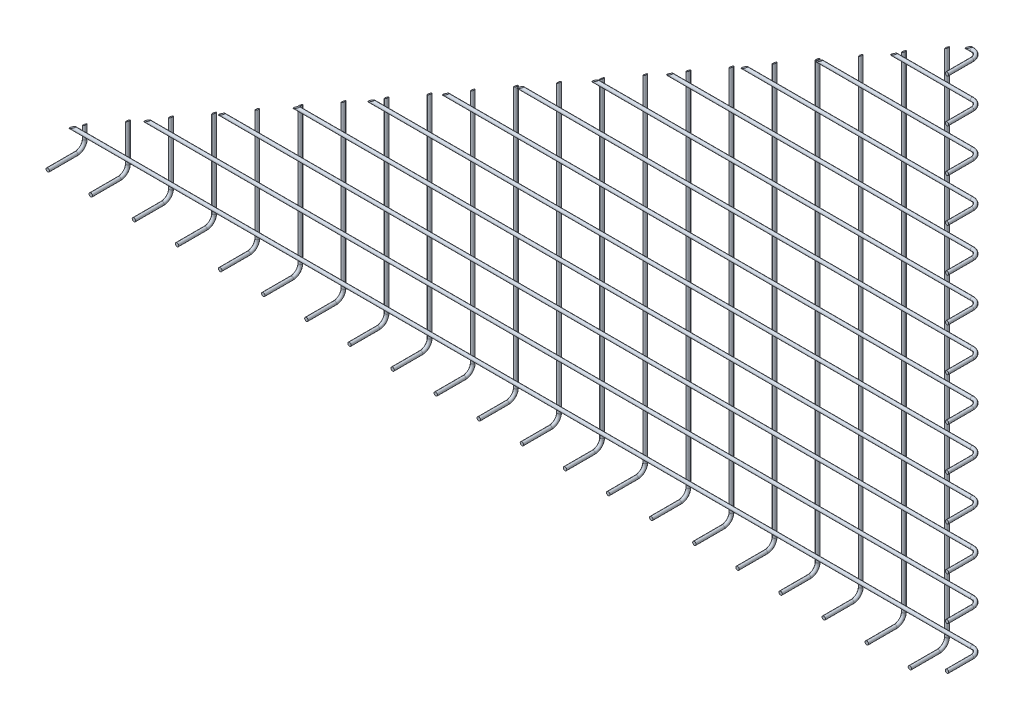
from build123d import *

# Parameters (mm, degrees)
SKETCH_1_R               = 2
PATTERN_LINEAR_1_COUNT   = 11
PATTERN_LINEAR_1_PITCH   = 50
SKETCH_4_R               = 2
PATTERN_LINEAR_2_COUNT   = 17
PATTERN_LINEAR_2_PITCH   = 50
CUT_EXTRUDE_1_DEPTH      = 1012.697275829
CUT_EXTRUDE_1_DEPTH_BACK = 1012.697275829
SKETCH_5_OUTSIDE_W       = 1368.726
SKETCH_5_OUTSIDE_H       = 1129.783


with BuildPart() as part:
    # По траектории1: sweep along a path in Эскиз2
    with BuildLine(Plane(origin=(0, 0, 0), x_dir=(0, 0, -1), z_dir=(1, 0, 0))) as sweep_1_path:
        Line((-47, 2), (-14, 2))
        ThreePointArc((-14, 2), (-6.928932188, 4.928932188), (-4, 12))
        Line((-4, 12), (-4, 851.056624327))
    # Эскиз1 → По траектории1 (sweep)
    with BuildSketch(Plane.XY.offset(47)):
        with Locations((0, 2)):
            Circle(SKETCH_1_R)
    sweep(path=sweep_1_path.line)


with BuildPart() as pattern_linear_1_1:
    # Линейный массив1: pattern copy
    add(part.part.moved(Location(Vector(1, 0, 0) * (1 * PATTERN_LINEAR_1_PITCH))))


with BuildPart() as pattern_linear_1_2:
    # Линейный массив1: pattern copy
    add(part.part.moved(Location(Vector(1, 0, 0) * (2 * PATTERN_LINEAR_1_PITCH))))


with BuildPart() as pattern_linear_1_3:
    # Линейный массив1: pattern copy
    add(part.part.moved(Location(Vector(1, 0, 0) * (3 * PATTERN_LINEAR_1_PITCH))))


with BuildPart() as pattern_linear_1_4:
    # Линейный массив1: pattern copy
    add(part.part.moved(Location(Vector(1, 0, 0) * (4 * PATTERN_LINEAR_1_PITCH))))


with BuildPart() as pattern_linear_1_5:
    # Линейный массив1: pattern copy
    add(part.part.moved(Location(Vector(1, 0, 0) * (5 * PATTERN_LINEAR_1_PITCH))))


with BuildPart() as pattern_linear_1_6:
    # Линейный массив1: pattern copy
    add(part.part.moved(Location(Vector(1, 0, 0) * (6 * PATTERN_LINEAR_1_PITCH))))


with BuildPart() as pattern_linear_1_7:
    # Линейный массив1: pattern copy
    add(part.part.moved(Location(Vector(1, 0, 0) * (7 * PATTERN_LINEAR_1_PITCH))))


with BuildPart() as pattern_linear_1_8:
    # Линейный массив1: pattern copy
    add(part.part.moved(Location(Vector(1, 0, 0) * (8 * PATTERN_LINEAR_1_PITCH))))


with BuildPart() as pattern_linear_1_9:
    # Линейный массив1: pattern copy
    add(part.part.moved(Location(Vector(1, 0, 0) * (9 * PATTERN_LINEAR_1_PITCH))))


with BuildPart() as pattern_linear_1_10:
    # Линейный массив1: pattern copy
    add(part.part.moved(Location(Vector(1, 0, 0) * (10 * PATTERN_LINEAR_1_PITCH))))


with BuildPart() as body_12:
    # Зеркальное отражение1: mirrored copy
    add(pattern_linear_1_10.part.mirror(Plane(origin=(0, 0, 0), x_dir=(0, 0, 1), z_dir=(1, 0, 0))))


with BuildPart() as body_13:
    # Mirror 1 2: mirrored copy
    add(pattern_linear_1_9.part.mirror(Plane(origin=(0, 0, 0), x_dir=(0, 0, 1), z_dir=(1, 0, 0))))


with BuildPart() as body_14:
    # Mirror 1 3: mirrored copy
    add(pattern_linear_1_8.part.mirror(Plane(origin=(0, 0, 0), x_dir=(0, 0, 1), z_dir=(1, 0, 0))))


with BuildPart() as body_15:
    # Mirror 1 4: mirrored copy
    add(pattern_linear_1_7.part.mirror(Plane(origin=(0, 0, 0), x_dir=(0, 0, 1), z_dir=(1, 0, 0))))


with BuildPart() as body_16:
    # Mirror 1 5: mirrored copy
    add(pattern_linear_1_6.part.mirror(Plane(origin=(0, 0, 0), x_dir=(0, 0, 1), z_dir=(1, 0, 0))))


with BuildPart() as body_17:
    # Mirror 1 6: mirrored copy
    add(pattern_linear_1_5.part.mirror(Plane(origin=(0, 0, 0), x_dir=(0, 0, 1), z_dir=(1, 0, 0))))


with BuildPart() as body_18:
    # Mirror 1 7: mirrored copy
    add(pattern_linear_1_4.part.mirror(Plane(origin=(0, 0, 0), x_dir=(0, 0, 1), z_dir=(1, 0, 0))))


with BuildPart() as body_19:
    # Mirror 1 8: mirrored copy
    add(pattern_linear_1_3.part.mirror(Plane(origin=(0, 0, 0), x_dir=(0, 0, 1), z_dir=(1, 0, 0))))


with BuildPart() as body_20:
    # Mirror 1 9: mirrored copy
    add(pattern_linear_1_2.part.mirror(Plane(origin=(0, 0, 0), x_dir=(0, 0, 1), z_dir=(1, 0, 0))))


with BuildPart() as body_21:
    # Mirror 1 10: mirrored copy
    add(pattern_linear_1_1.part.mirror(Plane(origin=(0, 0, 0), x_dir=(0, 0, 1), z_dir=(1, 0, 0))))


with BuildPart() as body_22:
    # По траектории2: sweep along a path in Эскиз3
    with BuildLine(Plane(origin=(0, 20, 0), x_dir=(1, 0, 0), z_dir=(0, 1, 0))) as sweep_2_path:
        Line((-543, -47), (-543, -18))
        ThreePointArc((-543, -18), (-540.071067812, -10.928932188), (-533, -8))
        Line((-533, -8), (533, -8))
        ThreePointArc((533, -8), (540.071067812, -10.928932188), (543, -18))
        Line((543, -18), (543, -47))
    # Эскиз4 → По траектории2 (sweep)
    with BuildSketch(Plane.XY.offset(47)):
        with Locations((543, 20)):
            Circle(SKETCH_4_R)
    sweep(path=sweep_2_path.line)


with BuildPart() as pattern_linear_2_1:
    # Линейный массив2: pattern copy
    add(body_22.part.moved(Location(Vector(0, 1, 0) * (1 * PATTERN_LINEAR_2_PITCH))))


with BuildPart() as pattern_linear_2_2:
    # Линейный массив2: pattern copy
    add(body_22.part.moved(Location(Vector(0, 1, 0) * (2 * PATTERN_LINEAR_2_PITCH))))


with BuildPart() as pattern_linear_2_3:
    # Линейный массив2: pattern copy
    add(body_22.part.moved(Location(Vector(0, 1, 0) * (3 * PATTERN_LINEAR_2_PITCH))))


with BuildPart() as pattern_linear_2_4:
    # Линейный массив2: pattern copy
    add(body_22.part.moved(Location(Vector(0, 1, 0) * (4 * PATTERN_LINEAR_2_PITCH))))


with BuildPart() as pattern_linear_2_5:
    # Линейный массив2: pattern copy
    add(body_22.part.moved(Location(Vector(0, 1, 0) * (5 * PATTERN_LINEAR_2_PITCH))))


with BuildPart() as pattern_linear_2_6:
    # Линейный массив2: pattern copy
    add(body_22.part.moved(Location(Vector(0, 1, 0) * (6 * PATTERN_LINEAR_2_PITCH))))


with BuildPart() as pattern_linear_2_7:
    # Линейный массив2: pattern copy
    add(body_22.part.moved(Location(Vector(0, 1, 0) * (7 * PATTERN_LINEAR_2_PITCH))))


with BuildPart() as pattern_linear_2_8:
    # Линейный массив2: pattern copy
    add(body_22.part.moved(Location(Vector(0, 1, 0) * (8 * PATTERN_LINEAR_2_PITCH))))


with BuildPart() as pattern_linear_2_9:
    # Линейный массив2: pattern copy
    add(body_22.part.moved(Location(Vector(0, 1, 0) * (9 * PATTERN_LINEAR_2_PITCH))))


with BuildPart() as pattern_linear_2_10:
    # Линейный массив2: pattern copy
    add(body_22.part.moved(Location(Vector(0, 1, 0) * (10 * PATTERN_LINEAR_2_PITCH))))


with BuildPart() as pattern_linear_2_11:
    # Линейный массив2: pattern copy
    add(body_22.part.moved(Location(Vector(0, 1, 0) * (11 * PATTERN_LINEAR_2_PITCH))))


with BuildPart() as pattern_linear_2_12:
    # Линейный массив2: pattern copy
    add(body_22.part.moved(Location(Vector(0, 1, 0) * (12 * PATTERN_LINEAR_2_PITCH))))


with BuildPart() as pattern_linear_2_13:
    # Линейный массив2: pattern copy
    add(body_22.part.moved(Location(Vector(0, 1, 0) * (13 * PATTERN_LINEAR_2_PITCH))))


with BuildPart() as pattern_linear_2_14:
    # Линейный массив2: pattern copy
    add(body_22.part.moved(Location(Vector(0, 1, 0) * (14 * PATTERN_LINEAR_2_PITCH))))


with BuildPart() as pattern_linear_2_15:
    # Линейный массив2: pattern copy
    add(body_22.part.moved(Location(Vector(0, 1, 0) * (15 * PATTERN_LINEAR_2_PITCH))))


with BuildPart() as pattern_linear_2_16:
    # Линейный массив2: pattern copy
    add(body_22.part.moved(Location(Vector(0, 1, 0) * (16 * PATTERN_LINEAR_2_PITCH))))


with BuildPart() as cut_extrude_1_tool:
    # Эскиз5 outside → Вырез-Вытянуть1 (new, two sides: drawn at the far end of the back side and taken through both)
    with BuildSketch(Plane.XY.offset(-CUT_EXTRUDE_1_DEPTH_BACK)):
        with Locations((0, 425.5285)):
            Rectangle(SKETCH_5_OUTSIDE_W, SKETCH_5_OUTSIDE_H)
        Polygon((545, 629.311793417), (545, 0), (-545, 0), align=None, mode=Mode.SUBTRACT)
    extrude(amount=CUT_EXTRUDE_1_DEPTH + CUT_EXTRUDE_1_DEPTH_BACK)


with BuildPart() as part_1:
    add(part.part)

    # Вырез-Вытянуть1: cut by cut_extrude_1_tool
    add(cut_extrude_1_tool.part, mode=Mode.SUBTRACT)


with BuildPart() as pattern_linear_1_1_1:
    add(pattern_linear_1_1.part)

    # Вырез-Вытянуть1: cut by cut_extrude_1_tool
    add(cut_extrude_1_tool.part, mode=Mode.SUBTRACT)


with BuildPart() as pattern_linear_1_2_1:
    add(pattern_linear_1_2.part)

    # Вырез-Вытянуть1: cut by cut_extrude_1_tool
    add(cut_extrude_1_tool.part, mode=Mode.SUBTRACT)


with BuildPart() as pattern_linear_1_3_1:
    add(pattern_linear_1_3.part)

    # Вырез-Вытянуть1: cut by cut_extrude_1_tool
    add(cut_extrude_1_tool.part, mode=Mode.SUBTRACT)


with BuildPart() as pattern_linear_1_4_1:
    add(pattern_linear_1_4.part)

    # Вырез-Вытянуть1: cut by cut_extrude_1_tool
    add(cut_extrude_1_tool.part, mode=Mode.SUBTRACT)


with BuildPart() as pattern_linear_1_5_1:
    add(pattern_linear_1_5.part)

    # Вырез-Вытянуть1: cut by cut_extrude_1_tool
    add(cut_extrude_1_tool.part, mode=Mode.SUBTRACT)


with BuildPart() as pattern_linear_1_6_1:
    add(pattern_linear_1_6.part)

    # Вырез-Вытянуть1: cut by cut_extrude_1_tool
    add(cut_extrude_1_tool.part, mode=Mode.SUBTRACT)


with BuildPart() as pattern_linear_1_7_1:
    add(pattern_linear_1_7.part)

    # Вырез-Вытянуть1: cut by cut_extrude_1_tool
    add(cut_extrude_1_tool.part, mode=Mode.SUBTRACT)


with BuildPart() as pattern_linear_1_8_1:
    add(pattern_linear_1_8.part)

    # Вырез-Вытянуть1: cut by cut_extrude_1_tool
    add(cut_extrude_1_tool.part, mode=Mode.SUBTRACT)


with BuildPart() as pattern_linear_1_9_1:
    add(pattern_linear_1_9.part)

    # Вырез-Вытянуть1: cut by cut_extrude_1_tool
    add(cut_extrude_1_tool.part, mode=Mode.SUBTRACT)


with BuildPart() as pattern_linear_1_10_1:
    add(pattern_linear_1_10.part)

    # Вырез-Вытянуть1: cut by cut_extrude_1_tool
    add(cut_extrude_1_tool.part, mode=Mode.SUBTRACT)


with BuildPart() as body_12_1:
    add(body_12.part)

    # Вырез-Вытянуть1: cut by cut_extrude_1_tool
    add(cut_extrude_1_tool.part, mode=Mode.SUBTRACT)


with BuildPart() as body_13_1:
    add(body_13.part)

    # Вырез-Вытянуть1: cut by cut_extrude_1_tool
    add(cut_extrude_1_tool.part, mode=Mode.SUBTRACT)


with BuildPart() as body_14_1:
    add(body_14.part)

    # Вырез-Вытянуть1: cut by cut_extrude_1_tool
    add(cut_extrude_1_tool.part, mode=Mode.SUBTRACT)


with BuildPart() as body_15_1:
    add(body_15.part)

    # Вырез-Вытянуть1: cut by cut_extrude_1_tool
    add(cut_extrude_1_tool.part, mode=Mode.SUBTRACT)


with BuildPart() as body_16_1:
    add(body_16.part)

    # Вырез-Вытянуть1: cut by cut_extrude_1_tool
    add(cut_extrude_1_tool.part, mode=Mode.SUBTRACT)


with BuildPart() as body_17_1:
    add(body_17.part)

    # Вырез-Вытянуть1: cut by cut_extrude_1_tool
    add(cut_extrude_1_tool.part, mode=Mode.SUBTRACT)


with BuildPart() as body_18_1:
    add(body_18.part)

    # Вырез-Вытянуть1: cut by cut_extrude_1_tool
    add(cut_extrude_1_tool.part, mode=Mode.SUBTRACT)


with BuildPart() as body_19_1:
    add(body_19.part)

    # Вырез-Вытянуть1: cut by cut_extrude_1_tool
    add(cut_extrude_1_tool.part, mode=Mode.SUBTRACT)


with BuildPart() as body_20_1:
    add(body_20.part)

    # Вырез-Вытянуть1: cut by cut_extrude_1_tool
    add(cut_extrude_1_tool.part, mode=Mode.SUBTRACT)


with BuildPart() as body_21_1:
    add(body_21.part)

    # Вырез-Вытянуть1: cut by cut_extrude_1_tool
    add(cut_extrude_1_tool.part, mode=Mode.SUBTRACT)


with BuildPart() as body_22_1:
    add(body_22.part)

    # Вырез-Вытянуть1: cut by cut_extrude_1_tool
    add(cut_extrude_1_tool.part, mode=Mode.SUBTRACT)


with BuildPart() as pattern_linear_2_1_1:
    add(pattern_linear_2_1.part)

    # Вырез-Вытянуть1: cut by cut_extrude_1_tool
    add(cut_extrude_1_tool.part, mode=Mode.SUBTRACT)


with BuildPart() as pattern_linear_2_2_1:
    add(pattern_linear_2_2.part)

    # Вырез-Вытянуть1: cut by cut_extrude_1_tool
    add(cut_extrude_1_tool.part, mode=Mode.SUBTRACT)


with BuildPart() as pattern_linear_2_3_1:
    add(pattern_linear_2_3.part)

    # Вырез-Вытянуть1: cut by cut_extrude_1_tool
    add(cut_extrude_1_tool.part, mode=Mode.SUBTRACT)


with BuildPart() as pattern_linear_2_4_1:
    add(pattern_linear_2_4.part)

    # Вырез-Вытянуть1: cut by cut_extrude_1_tool
    add(cut_extrude_1_tool.part, mode=Mode.SUBTRACT)


with BuildPart() as pattern_linear_2_5_1:
    add(pattern_linear_2_5.part)

    # Вырез-Вытянуть1: cut by cut_extrude_1_tool
    add(cut_extrude_1_tool.part, mode=Mode.SUBTRACT)


with BuildPart() as pattern_linear_2_6_1:
    add(pattern_linear_2_6.part)

    # Вырез-Вытянуть1: cut by cut_extrude_1_tool
    add(cut_extrude_1_tool.part, mode=Mode.SUBTRACT)


with BuildPart() as pattern_linear_2_7_1:
    add(pattern_linear_2_7.part)

    # Вырез-Вытянуть1: cut by cut_extrude_1_tool
    add(cut_extrude_1_tool.part, mode=Mode.SUBTRACT)


with BuildPart() as pattern_linear_2_8_1:
    add(pattern_linear_2_8.part)

    # Вырез-Вытянуть1: cut by cut_extrude_1_tool
    add(cut_extrude_1_tool.part, mode=Mode.SUBTRACT)


with BuildPart() as pattern_linear_2_9_1:
    add(pattern_linear_2_9.part)

    # Вырез-Вытянуть1: cut by cut_extrude_1_tool
    add(cut_extrude_1_tool.part, mode=Mode.SUBTRACT)


with BuildPart() as pattern_linear_2_10_1:
    add(pattern_linear_2_10.part)

    # Вырез-Вытянуть1: cut by cut_extrude_1_tool
    add(cut_extrude_1_tool.part, mode=Mode.SUBTRACT)


with BuildPart() as pattern_linear_2_11_1:
    add(pattern_linear_2_11.part)

    # Вырез-Вытянуть1: cut by cut_extrude_1_tool
    add(cut_extrude_1_tool.part, mode=Mode.SUBTRACT)


with BuildPart() as pattern_linear_2_12_1:
    add(pattern_linear_2_12.part)

    # Вырез-Вытянуть1: cut by cut_extrude_1_tool
    add(cut_extrude_1_tool.part, mode=Mode.SUBTRACT)


with BuildPart() as pattern_linear_2_13_1:
    add(pattern_linear_2_13.part)

    # Вырез-Вытянуть1: cut by cut_extrude_1_tool
    add(cut_extrude_1_tool.part, mode=Mode.SUBTRACT)


with BuildPart() as pattern_linear_2_14_1:
    add(pattern_linear_2_14.part)

    # Вырез-Вытянуть1: cut by cut_extrude_1_tool
    add(cut_extrude_1_tool.part, mode=Mode.SUBTRACT)


with BuildPart() as pattern_linear_2_15_1:
    add(pattern_linear_2_15.part)

    # Вырез-Вытянуть1: cut by cut_extrude_1_tool
    add(cut_extrude_1_tool.part, mode=Mode.SUBTRACT)


with BuildPart() as pattern_linear_2_16_1:
    add(pattern_linear_2_16.part)

    # Вырез-Вытянуть1: cut by cut_extrude_1_tool
    add(cut_extrude_1_tool.part, mode=Mode.SUBTRACT)


solid = Compound([part_1.part, pattern_linear_1_1_1.part, pattern_linear_1_2_1.part, pattern_linear_1_3_1.part, pattern_linear_1_4_1.part, pattern_linear_1_5_1.part, pattern_linear_1_6_1.part, pattern_linear_1_7_1.part, pattern_linear_1_8_1.part, pattern_linear_1_9_1.part, pattern_linear_1_10_1.part, body_12_1.part, body_13_1.part, body_14_1.part, body_15_1.part, body_16_1.part, body_17_1.part, body_18_1.part, body_19_1.part, body_20_1.part, body_21_1.part, body_22_1.part, pattern_linear_2_1_1.part, pattern_linear_2_2_1.part, pattern_linear_2_3_1.part, pattern_linear_2_4_1.part, pattern_linear_2_5_1.part, pattern_linear_2_6_1.part, pattern_linear_2_7_1.part, pattern_linear_2_8_1.part, pattern_linear_2_9_1.part, pattern_linear_2_10_1.part, pattern_linear_2_11_1.part, pattern_linear_2_12_1.part])
